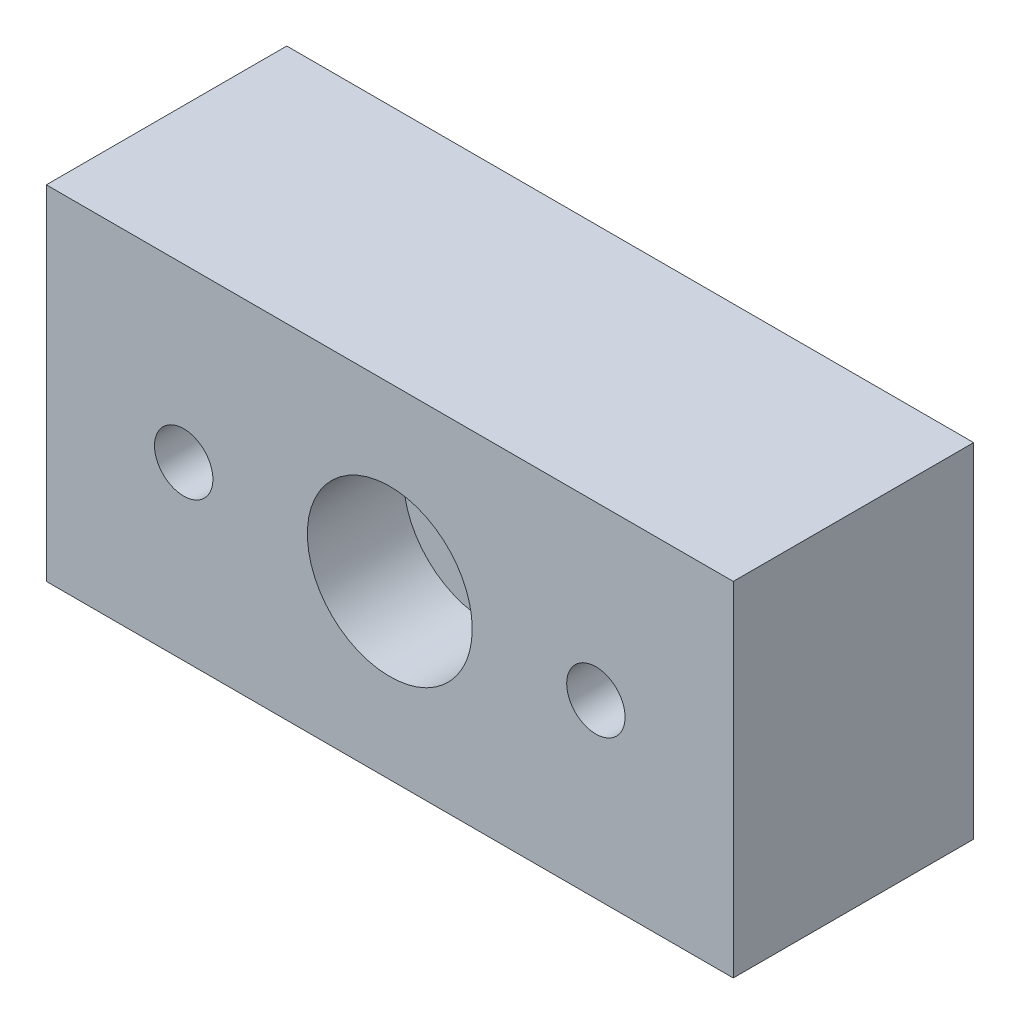
from build123d import *

# Parameters (mm, degrees)
SKETCH_1_W                     = 100
SKETCH_1_H                     = 50
EXTRUDE_1_DEPTH                = 35
HOLE_WIZARD_8_5_8_5_1_D        = 8.5
HOLE_WIZARD_1_D                = 24
HOLE_WIZARD_1_DEPTH            = 14
HOLE_WIZARD_2_D                = 8.5
HOLE_WIZARD_3_D                = 16
HOLE_WIZARD_3_DEPTH            = 20
HOLE_WIZARD_M3_5_1_D           = 2.9
HOLE_WIZARD_M3_5_1_DEPTH       = 10
HOLE_WIZARD_M3_5_1_CSINK_D     = 3.55
HOLE_WIZARD_M3_5_1_CSINK_ANGLE = 90
HOLE_WIZARD_M3_5_1_TIP         = 0.871247898


with BuildPart() as part:
    # 草图1 → 凸台-拉伸1 (new body)
    with BuildSketch(Plane.XY):
        Rectangle(SKETCH_1_W, SKETCH_1_H)
    extrude(amount=EXTRUDE_1_DEPTH)

    # Ø8.5 (8.5) 直径孔1 (through all)
    with Locations(Plane.XY.offset(35)):
        with Locations((0, 0)):
            Hole(HOLE_WIZARD_8_5_8_5_1_D / 2)

    # 孔1
    with Locations(Plane.XY.offset(35)):
        with Locations((0, 0)):
            Hole(HOLE_WIZARD_1_D / 2, depth=HOLE_WIZARD_1_DEPTH)

    # 孔2 (through all)
    with Locations(Plane(origin=(0, 0, 0), x_dir=(-1, 0, 0), z_dir=(0, 0, -1))):
        with Locations((30, 0)):
            hole_wizard_2 = Hole(HOLE_WIZARD_2_D / 2)

    # 镜向1: 孔2 across plane
    add(hole_wizard_2.mirror(Plane.ZY), mode=Mode.SUBTRACT)

    # 孔3
    with Locations(Plane(origin=(0, 0, 0), x_dir=(-1, 0, 0), z_dir=(0, 0, -1))):
        with Locations((30, 0), (-30, 0)):
            Hole(HOLE_WIZARD_3_D / 2, depth=HOLE_WIZARD_3_DEPTH)

    # M3.5 螺纹孔1
    with Locations(Plane(origin=(0, 0, 0), x_dir=(-1, 0, 0), z_dir=(0, 0, -1))):
        with Locations((21.077002862, -8.023722457), (38.023722457, -8.922997138), (38.922997138, 8.023722457), (21.976277543, 8.922997138), (-21.077002862, -8.023722457), (-38.023722457, -8.922997138), (-38.922997138, 8.023722457), (-21.976277543, 8.922997138)):
            CounterSinkHole(HOLE_WIZARD_M3_5_1_D / 2, HOLE_WIZARD_M3_5_1_CSINK_D / 2, depth=HOLE_WIZARD_M3_5_1_DEPTH, counter_sink_angle=HOLE_WIZARD_M3_5_1_CSINK_ANGLE)
            with Locations((0, 0, -(HOLE_WIZARD_M3_5_1_DEPTH + HOLE_WIZARD_M3_5_1_TIP / 2))):  # 118° drill point
                Cone(0, HOLE_WIZARD_M3_5_1_D / 2, HOLE_WIZARD_M3_5_1_TIP, mode=Mode.SUBTRACT)


solid = part.part
